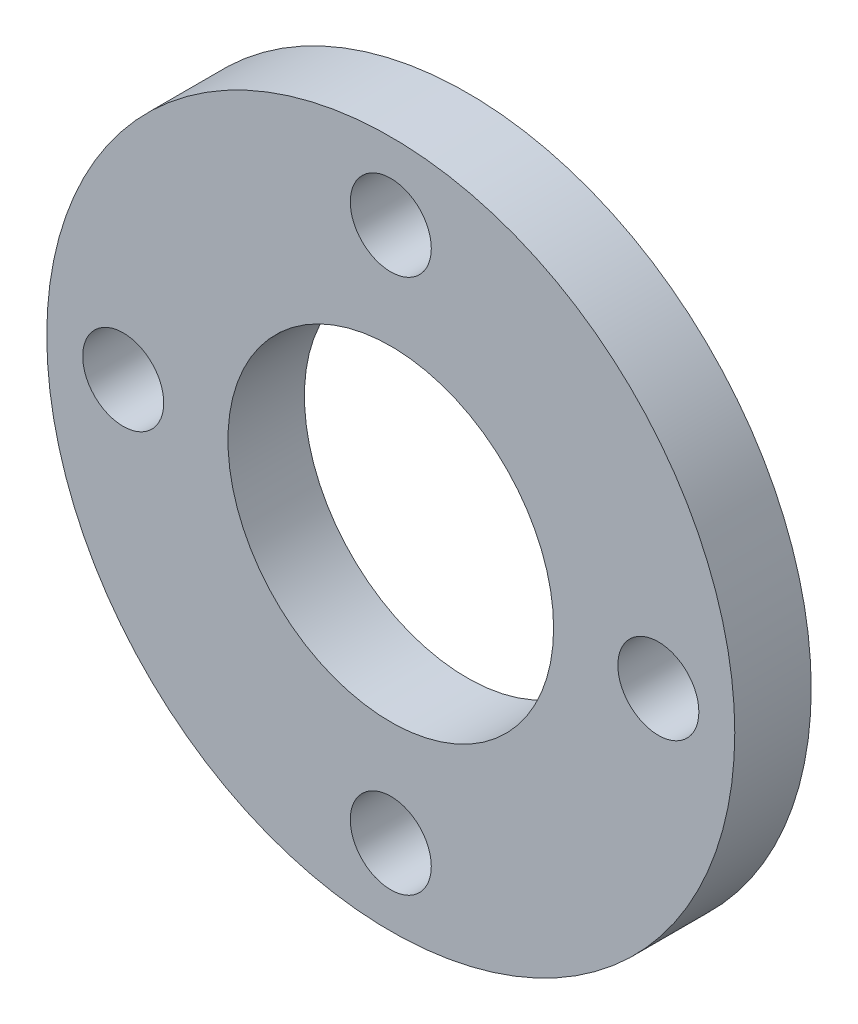
from build123d import *

# Parameters (mm, degrees)
SZKIC1_R                    = 45
SZKIC1_R_2                  = 5.3
SZKIC1_R_3                  = 21.3
DODANIE_WYCI_GNI_CIE3_DEPTH = 10


with BuildPart() as part:
    # Szkic1 → Dodanie-wyciągnięcie3 (new body)
    with BuildSketch(Plane.XY):
        Circle(SZKIC1_R)
        with Locations((0, 35)):
            Circle(SZKIC1_R_2, mode=Mode.SUBTRACT)
        with Locations((35, 0)):
            Circle(SZKIC1_R_2, mode=Mode.SUBTRACT)
        with Locations((0, -35)):
            Circle(SZKIC1_R_2, mode=Mode.SUBTRACT)
        with Locations((-35, 0)):
            Circle(SZKIC1_R_2, mode=Mode.SUBTRACT)
        Circle(SZKIC1_R_3, mode=Mode.SUBTRACT)
    extrude(amount=DODANIE_WYCI_GNI_CIE3_DEPTH)


solid = part.part
